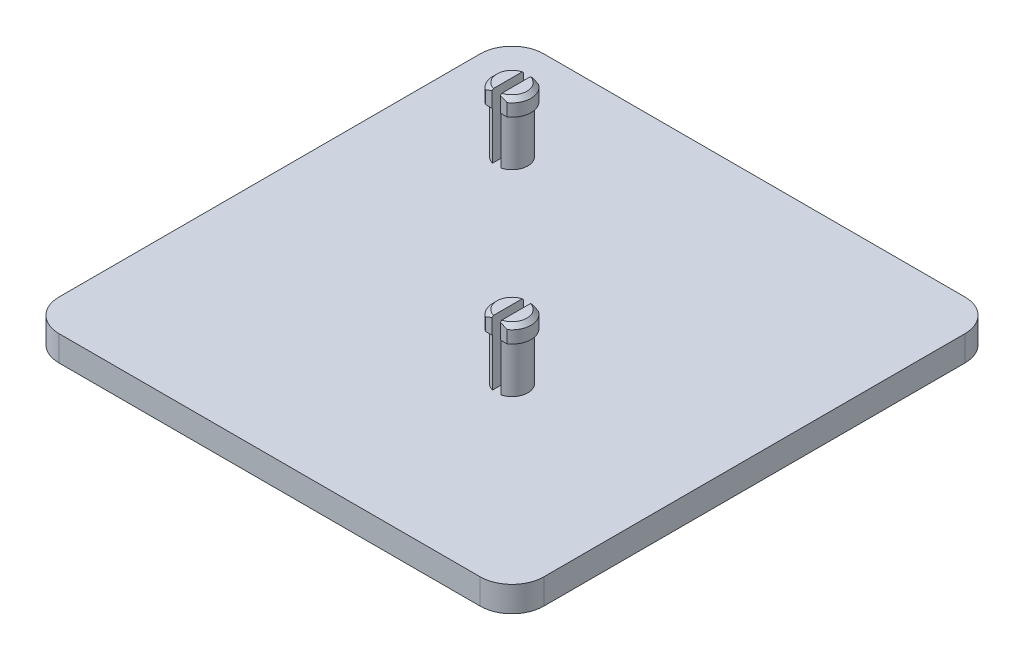
from build123d import *

# Parameters (mm, degrees)
BASE_PROFILE_W              = 76.2
BASE_PROFILE_H              = 76.2
BASE_DEPTH                  = 2
CONNECTOR_PROFILE_R         = 2.5
CONNECTOR_BODY_DEPTH        = 7.5
HEAD_PROFILE_R              = 3
CONNECTOR_HEAD_DEPTH        = 2.6
CONNECTOR_HEAD_CHAMFER_SIZE = 0.65
CONNECTOR_GAP_REACH         = 57.696
TRIM_START                  = -2.6
TRIM_HEAD_DEPTH             = 2.39107
ROUND_EDGE_R                = 5


with BuildPart() as part:
    # Base Profile → Base (new, symmetric)
    with BuildSketch(Plane(origin=(0, 0, 0), x_dir=(1, 0, 0), z_dir=(0, 1, 0))):
        Rectangle(BASE_PROFILE_W, BASE_PROFILE_H)
    extrude(amount=BASE_DEPTH, both=True)

    # Connector Profile → Connector Body (add)
    with BuildSketch(Plane(origin=(0, 2, 0), x_dir=(1, 0, 0), z_dir=(0, 1, 0))):
        with Locations(Location((-21.59, 21.59, 0), (0, 0, 90))):
            Circle(CONNECTOR_PROFILE_R)
        with Locations(Location((9.302081056, -9.302081056, 0), (0, 0, 90))):
            Circle(CONNECTOR_PROFILE_R)
    extrude(amount=CONNECTOR_BODY_DEPTH)

    # Head Profile → Connector Head (add)
    with BuildSketch(Plane(origin=(0, 9.5, 0), x_dir=(1, 0, 0), z_dir=(0, 1, 0))):
        with Locations(Location((-21.59, 21.59, 0), (0, 0, 270))):
            Circle(HEAD_PROFILE_R)
        with Locations(Location((9.302081056, -9.302081056, 0), (0, 0, 270))):
            Circle(HEAD_PROFILE_R)
    extrude(amount=CONNECTOR_HEAD_DEPTH)

    # Connector Head Chamfer
    connector_head_chamfer_edges = [part.edges().sort_by_distance(p)[0] for p in [
        (-21.59, 12.1, -24.59),
        (9.302081056, 12.1, 6.302081056),
    ]]
    chamfer(connector_head_chamfer_edges, length=CONNECTOR_HEAD_CHAMFER_SIZE)

    # Connector Gap: up to this face of the body (flat: up to its plane)
    connector_gap_end = Plane(part.part.faces().sort_by_distance((0.041835549, 2, 0.041835549))[0])
    # Gap Profile → Connector Gap (cut, up to the picked face)
    with BuildSketch(Plane(origin=(0, 12.1, 0), x_dir=(1, 0, 0), z_dir=(0, 1, 0)), mode=Mode.PRIVATE) as connector_gap_sk1:
        with BuildLine():
            Line((-22.24, 24.518736929), (-22.24, 18.661263071))
            ThreePointArc((-22.24, 18.661263071), (-21.59, 18.59), (-20.94, 18.661263071))
            Line((-20.94, 18.661263071), (-20.94, 24.518736929))
            ThreePointArc((-20.94, 24.518736929), (-21.59, 24.59), (-22.24, 24.518736929))
        make_face()
    connector_gap_tool1 = split(extrude(connector_gap_sk1.sketch, amount=-CONNECTOR_GAP_REACH, mode=Mode.PRIVATE), bisect_by=connector_gap_end, keep=Keep.BOTH, mode=Mode.PRIVATE)
    # Gap Profile → Connector Gap (cut, up to the picked face)
    with BuildSketch(Plane(origin=(0, 12.1, 0), x_dir=(1, 0, 0), z_dir=(0, 1, 0)), mode=Mode.PRIVATE) as connector_gap_sk2:
        with BuildLine():
            Line((8.652081056, -6.373344127), (8.652081056, -12.230817986))
            ThreePointArc((8.652081056, -12.230817986), (9.302081056, -12.302081056), (9.952081056, -12.230817986))
            Line((9.952081056, -12.230817986), (9.952081056, -6.373344127))
            ThreePointArc((9.952081056, -6.373344127), (9.302081056, -6.302081056), (8.652081056, -6.373344127))
        make_face()
    connector_gap_tool2 = split(extrude(connector_gap_sk2.sketch, amount=-CONNECTOR_GAP_REACH, mode=Mode.PRIVATE), bisect_by=connector_gap_end, keep=Keep.BOTH, mode=Mode.PRIVATE)
    add(connector_gap_tool1.solids().sort_by(Axis((-21.59, 12.1, -21.59), (0, -1, 0)))[0], mode=Mode.SUBTRACT)
    add(connector_gap_tool2.solids().sort_by(Axis((9.302081, 12.1, 9.302081), (0, -1, 0)))[0], mode=Mode.SUBTRACT)

    # Trim Profile → Trim Head (cut)
    with BuildSketch(Plane(origin=(0, 12.1, 0), x_dir=(1, 0, 0), z_dir=(0, 1, 0)).offset(TRIM_START)):
        with BuildLine():
            Line((7.606682873, -6.827081056), (10.99747924, -6.827081056))
            ThreePointArc((10.99747924, -6.827081056), (9.302081056, -6.302081056), (7.606682873, -6.827081056))
        make_face()
        with BuildLine():
            Line((7.606682873, -11.777081056), (10.99747924, -11.777081056))
            ThreePointArc((10.99747924, -11.777081056), (9.302081056, -12.302081056), (7.606682873, -11.777081056))
        make_face()
        with BuildLine():
            Line((-23.285398183, 24.065), (-19.894601817, 24.065))
            ThreePointArc((-19.894601817, 24.065), (-21.59, 24.59), (-23.285398183, 24.065))
        make_face()
        with BuildLine():
            Line((-23.285398183, 19.115), (-19.894601817, 19.115))
            ThreePointArc((-19.894601817, 19.115), (-21.59, 18.59), (-23.285398183, 19.115))
        make_face()
    extrude(amount=TRIM_HEAD_DEPTH, mode=Mode.SUBTRACT)

    # Round Edge
    round_edge_edges = [part.edges().sort_by_distance(p)[0] for p in [
        (38.1, 0, 38.1),
        (-38.1, 0, 38.1),
        (-38.1, 0, -38.1),
        (38.1, 0, -38.1),
    ]]
    fillet(round_edge_edges, radius=ROUND_EDGE_R)


solid = part.part
